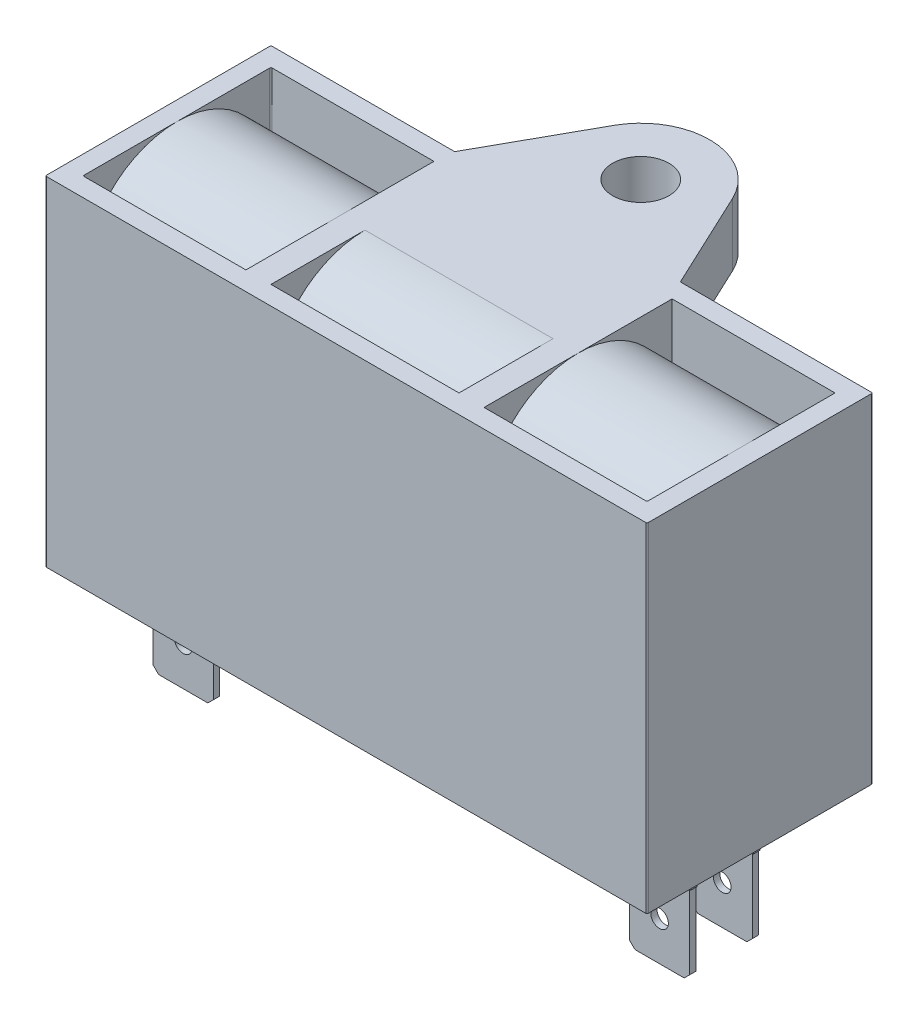
from build123d import *

# Parameters (mm, degrees)
SKETCH1_W            = 48
SKETCH1_H            = 18
BOSS_EXTRUDE1_DEPTH  = 27
SKETCH7_W            = 45
SKETCH7_H            = 15
CUT_EXTRUDE8_DEPTH   = 38.229020938
BOSS_EXTRUDE4_REACH  = 56.518
SKETCH10_W           = 2
SKETCH10_H           = 18
BOSS_EXTRUDE5_DEPTH  = 27
SKETCH11_R           = 2.25
BOSS_EXTRUDE7_DEPTH  = 5
FILLET1_R            = 0.5
SKETCH12_W           = 45
SKETCH12_H           = 15
CUT_EXTRUDE9_DEPTH   = 0.5
BOSS_EXTRUDE8_START  = 2.5
SKETCH15_R           = 0.7
BOSS_EXTRUDE8_DEPTH  = 0.5
BOSS_EXTRUDE9_START  = -2.5
SKETCH15_2_R         = 0.7
BOSS_EXTRUDE9_DEPTH  = 0.5
FILLET2_R            = 0.1
BOSS_EXTRUDE10_REACH = 41.715
SKETCH16_W           = 15
SKETCH16_H           = 7.5
FILLET3_R            = 0.1


with BuildPart() as part:
    # Sketch1 → Boss-Extrude1 (new body)
    with BuildSketch(Plane(origin=(0, 0, 0), x_dir=(1, 0, 0), z_dir=(0, 1, 0))):
        Rectangle(SKETCH1_W, SKETCH1_H)
    extrude(amount=BOSS_EXTRUDE1_DEPTH)

    # Sketch7 → Cut-Extrude8 (cut, through all)
    with BuildSketch(Plane(origin=(0, 27, 0), x_dir=(1, 0, 0), z_dir=(0, 1, 0))):
        Rectangle(SKETCH7_W, SKETCH7_H)
    extrude(amount=-CUT_EXTRUDE8_DEPTH, mode=Mode.SUBTRACT)


with BuildPart() as body_2:

    # Sketch9 → Boss-Extrude4 (new, up to next)
    with BuildSketch(Plane.ZY.offset(-22.5), mode=Mode.PRIVATE) as boss_extrude4_sk1:
        with BuildLine():
            Line((-7.5, 0), (-7.5, 19.5))
            ThreePointArc((-7.5, 19.5), (0, 27), (7.5, 19.5))
            Line((7.5, 19.5), (7.5, 0))
            Line((7.5, 0), (-7.5, 0))
        make_face()
    boss_extrude4_tool1 = extrude(boss_extrude4_sk1.sketch, amount=BOSS_EXTRUDE4_REACH, mode=Mode.PRIVATE) - part.part
    add(boss_extrude4_tool1.solids().sort_by_distance((22.5, 12.750425, 0))[0])


with BuildPart() as part_1:
    add(part.part)

    add(body_2.part)  # Boss-Extrude5 merges body 2
    # Sketch10 → Boss-Extrude5 (add)
    with BuildSketch(Plane(origin=(0, 27, 0), x_dir=(1, 0, 0), z_dir=(0, 1, 0))):
        with Locations((-8.5, 0)):
            Rectangle(SKETCH10_W, SKETCH10_H)
        with Locations((8.5, 0)):
            Rectangle(SKETCH10_W, SKETCH10_H)
    extrude(amount=-BOSS_EXTRUDE5_DEPTH)

    # Sketch11 → Boss-Extrude7 (add)
    with BuildSketch(Plane(origin=(0, 27, 0), x_dir=(1, 0, 0), z_dir=(0, 1, 0))):
        with BuildLine():
            Line((-9.34326642, 9), (8.65673358, 9))
            Line((8.65673358, 9), (4.978963589, 16.836647508))
            ThreePointArc((4.978963589, 16.836647508), (0.186765378, 19.996828057), (-4.808879939, 17.169208446))
            Line((-4.808879939, 17.169208446), (-9.34326642, 9))
        make_face()
        with Locations(Location((0, 14.5, 0), (0, 0, 270))):
            Circle(SKETCH11_R, mode=Mode.SUBTRACT)
    extrude(amount=-BOSS_EXTRUDE7_DEPTH)

    # Fillet1
    fillet1_edges = [part_1.edges().sort_by_distance(p)[0] for p in [
        (-0.34326642, 22, -9),
    ]]
    fillet(fillet1_edges, radius=FILLET1_R)

    # Sketch12 → Cut-Extrude9 (cut)
    with BuildSketch(Plane.XZ):
        Rectangle(SKETCH12_W, SKETCH12_H)
    extrude(amount=-CUT_EXTRUDE9_DEPTH, mode=Mode.SUBTRACT)

    # Sketch15<2> → Boss-Extrude9 (add)
    with BuildSketch(Plane.XY.offset(BOSS_EXTRUDE9_START)):
        Polygon((21.5, 0.5), (16.5, 0.5), (16.5, -2.6), (16.6, -2.6), (16.6, -8.5), (17.035978299, -8.935978299), (20.964021701, -8.935978299), (21.4, -8.5), (21.4, -2.6), (21.5, -2.6), align=None)
        with Locations((19, -5.8)):
            Circle(SKETCH15_2_R, mode=Mode.SUBTRACT)
    boss_extrude9 = extrude(amount=BOSS_EXTRUDE9_DEPTH)


with BuildPart() as body_2_2:
    # Sketch15 → Boss-Extrude8 (new body)
    with BuildSketch(Plane.XY.offset(BOSS_EXTRUDE8_START)):
        Polygon((21.5, 0.5), (16.5, 0.5), (16.5, -2.6), (16.6, -2.6), (16.6, -8.5), (17.035978299, -8.935978299), (20.964021701, -8.935978299), (21.4, -8.5), (21.4, -2.6), (21.5, -2.6), align=None)
        with Locations((19, -5.8)):
            Circle(SKETCH15_R, mode=Mode.SUBTRACT)
    boss_extrude8 = extrude(amount=BOSS_EXTRUDE8_DEPTH)


with BuildPart() as part_2:
    add(part_1.part)

    # Mirror1: Boss-Extrude8, Boss-Extrude9 across plane
    add(boss_extrude8.mirror(Plane(origin=(0, 0, 0), x_dir=(0, 0, 1), z_dir=(1, 0, 0))))
    add(boss_extrude9.mirror(Plane(origin=(0, 0, 0), x_dir=(0, 0, 1), z_dir=(1, 0, 0))))

    # Fillet2
    fillet2_edges = [part_2.edges().sort_by_distance(p)[0] for p in [
        (22.5, 23.25, -7.5),
        (22.5, 23.25, 7.5),
        (-22.5, 23.25, -7.5),
        (-22.5, 23.25, 7.5),
        (24, 13.5, 9),
        (-24, 13.5, 9),
        (-24, 13.5, -9),
        (24, 13.5, -9),
    ]]
    fillet(fillet2_edges, radius=FILLET2_R)

    # Sketch16 → Boss-Extrude10 (add, up to next)
    with BuildSketch(Plane.XY.offset(-7.5), mode=Mode.PRIVATE) as boss_extrude10_sk1:
        with Locations((0, 23.25)):
            Rectangle(SKETCH16_W, SKETCH16_H)
    boss_extrude10_tool1 = extrude(boss_extrude10_sk1.sketch, amount=BOSS_EXTRUDE10_REACH, mode=Mode.PRIVATE) - part_2.part
    add(boss_extrude10_tool1.solids().sort_by_distance((0, 23.25, -7.5))[0])

    # Fillet3
    fillet3_edges = [part_2.edges().sort_by_distance(p)[0] for p in [
        (22.5, 0.25, -7.5),
        (-22.5, 0.25, -7.5),
        (-22.5, 0.25, 7.5),
        (22.5, 0.25, 7.5),
    ]]
    fillet(fillet3_edges, radius=FILLET3_R)


solid = Compound([body_2_2.part, part_2.part])
